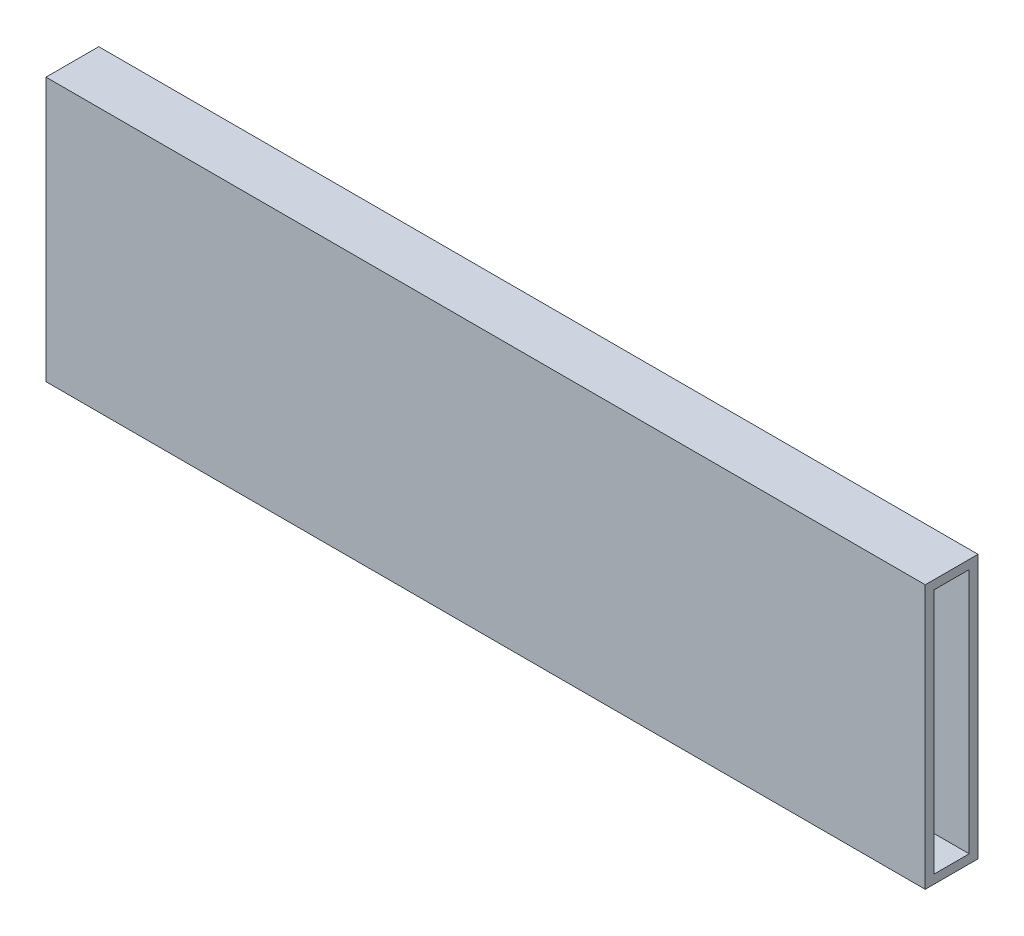
from build123d import *

# Parameters (mm, degrees)
SZKIC1_W                    = 100
SZKIC1_H                    = 30
DODANIE_WYCI_GNI_CIE1_DEPTH = 6
SZKIC2_W                    = 4
SZKIC2_H                    = 28
WYTNIJ_WYCI_GNI_CIE1_DEPTH  = 102.402421053


with BuildPart() as part:
    # Szkic1 → Dodanie-wyciągnięcie1 (new body)
    with BuildSketch(Plane.XY):
        with Locations((22.399352056, 0.698757764)):
            Rectangle(SZKIC1_W, SZKIC1_H)
    extrude(amount=DODANIE_WYCI_GNI_CIE1_DEPTH)

    # Szkic2 → Wytnij-wyciągnięcie1 (cut, through all)
    with BuildSketch(Plane(origin=(72.399352056, 0, 0), x_dir=(0, 0, -1), z_dir=(1, 0, 0))):
        with Locations((-3, 0.698757764)):
            Rectangle(SZKIC2_W, SZKIC2_H)
    extrude(amount=-WYTNIJ_WYCI_GNI_CIE1_DEPTH, mode=Mode.SUBTRACT)


solid = part.part
